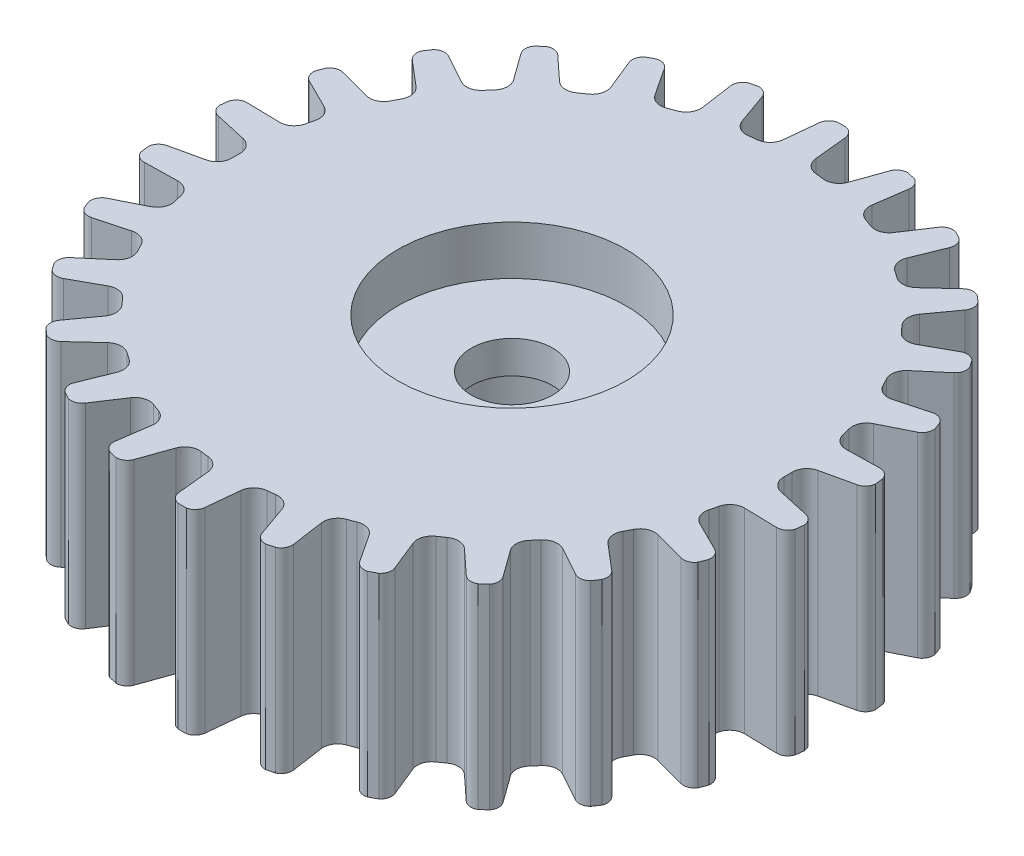
from build123d import *

# Parameters (mm, degrees)
SKETCH1_R           = 10.125
SKETCH1_R_2         = 2.45
BOSS_EXTRUDE1_DEPTH = 6
CUT_EXTRUDE1_START  = -6
SKETCH2_R           = 11.178148921
CUT_EXTRUDE1_DEPTH  = 6
BOSS_EXTRUDE2_START = -2.5
SKETCH3_R           = 2.45
SKETCH3_R_2         = 1.25
BOSS_EXTRUDE2_DEPTH = 2.5
SKETCH4_R           = 3.5
CUT_EXTRUDE2_DEPTH  = 1.5


with BuildPart() as part:
    # Sketch1 → Boss-Extrude1 (new body)
    with BuildSketch(Plane(origin=(0, 0, 0), x_dir=(1, 0, 0), z_dir=(0, 1, 0))):
        with Locations(Location((0, 0, 0), (0, 0, 270))):
            Circle(SKETCH1_R)
        with Locations(Location((0, 0, 0), (0, 0, 270))):
            Circle(SKETCH1_R_2, mode=Mode.SUBTRACT)
    extrude(amount=BOSS_EXTRUDE1_DEPTH)

    # Sketch2 → Cut-Extrude1 (cut)
    with BuildSketch(Plane(origin=(0, 6, 0), x_dir=(1, 0, 0), z_dir=(0, 1, 0)).offset(CUT_EXTRUDE1_START)):
        Circle(SKETCH2_R)
        with BuildLine():
            Line((0.5, 8.825), (0.4, 9.825))
            ThreePointArc((0.4, 9.825), (0.265875857, 10.062834476), (0, 10.125))
            ThreePointArc((0, 10.125), (-0.265875857, 10.062834476), (-0.4, 9.825))
            Line((-0.4, 9.825), (-0.5, 8.825))
            ThreePointArc((-0.5, 8.825), (-0.628607324, 8.553607324), (-0.9, 8.425))
            ThreePointArc((-0.9, 8.425), (-1.021299439, 8.411157617), (-1.142386836, 8.39556891))
            ThreePointArc((-1.142386836, 8.39556891), (-1.436671081, 8.45549062), (-1.626489829, 8.688219371))
            Line((-1.626489829, 8.688219371), (-1.962899675, 9.635229622))
            ThreePointArc((-1.962899675, 9.635229622), (-2.150043929, 9.834055052), (-2.423071101, 9.830785901))
            ThreePointArc((-2.423071101, 9.830785901), (-2.666343905, 9.706798537), (-2.739653129, 9.44377709))
            Line((-2.739653129, 9.44377709), (-2.597431646, 8.448903707))
            ThreePointArc((-2.597431646, 8.448903707), (-2.657353357, 8.154619462), (-2.890082107, 7.964800714))
            ThreePointArc((-2.890082107, 7.964800714), (-3.004544106, 7.922331709), (-3.118382301, 7.878217871))
            ThreePointArc((-3.118382301, 7.878217871), (-3.418455385, 7.865971536), (-3.65845398, 8.046511012))
            Line((-3.65845398, 8.046511012), (-4.211722755, 8.885494721))
            ThreePointArc((-4.211722755, 8.885494721), (-4.441010978, 9.033756094), (-4.705322117, 8.96524226))
            ThreePointArc((-4.705322117, 8.96524226), (-4.911853737, 8.78663875), (-4.920087576, 8.513716183))
            Line((-4.920087576, 8.513716183), (-4.543910006, 7.58178784))
            ThreePointArc((-4.543910006, 7.58178784), (-4.531663671, 7.281714757), (-4.712203148, 7.041716161))
            ThreePointArc((-4.712203148, 7.041716161), (-4.813175591, 6.97308868), (-4.913148722, 6.903013446))
            ThreePointArc((-4.913148722, 6.903013446), (-5.201571488, 6.819310778), (-5.477802085, 6.937168682))
            Line((-5.477802085, 6.937168682), (-6.215775818, 7.619367164))
            ThreePointArc((-6.215775818, 7.619367164), (-6.473882611, 7.708448068), (-6.714116915, 7.578671325))
            ThreePointArc((-6.714116915, 7.578671325), (-6.871904484, 7.355831457), (-6.814584416, 7.088869037))
            Line((-6.814584416, 7.088869037), (-6.226312833, 6.274046023))
            ThreePointArc((-6.226312833, 6.274046023), (-6.142610165, 5.985623258), (-6.260468069, 5.709392661))
            ThreePointArc((-6.260468069, 5.709392661), (-6.342082805, 5.618595082), (-6.422380798, 5.526630971))
            ThreePointArc((-6.422380798, 5.526630971), (-6.682391163, 5.376336464), (-6.978800243, 5.424663323))
            Line((-6.978800243, 5.424663323), (-7.858590584, 5.910429683))
            ThreePointArc((-7.858590584, 5.910429683), (-8.130515718, 5.935153059), (-8.332711642, 5.751655561))
            ThreePointArc((-8.332711642, 5.751655561), (-8.432585121, 5.497529977), (-8.313042381, 5.25204259))
            Line((-8.313042381, 5.25204259), (-7.54686499, 4.601679457))
            ThreePointArc((-7.54686499, 4.601679457), (-7.396570484, 4.341669092), (-7.444897342, 4.045260012))
            ThreePointArc((-7.444897342, 4.045260012), (-7.502411219, 3.937569161), (-7.558367446, 3.829060792))
            ThreePointArc((-7.558367446, 3.829060792), (-7.774854553, 3.620909018), (-8.074215898, 3.596896249))
            Line((-8.074215898, 3.596896249), (-9.04469263, 3.857999512))
            ThreePointArc((-9.04469263, 3.857999512), (-9.314632804, 3.816928528), (-9.467039457, 3.590374481))
            ThreePointArc((-9.467039457, 3.590374481), (-9.503194561, 3.319732038), (-9.328376539, 3.109986518))
            Line((-9.328376539, 3.109986518), (-8.428820785, 2.661880007))
            ThreePointArc((-8.428820785, 2.661880007), (-8.220669011, 2.445392901), (-8.196656243, 2.146031555))
            ThreePointArc((-8.196656243, 2.146031555), (-8.226726764, 2.027706032), (-8.255089252, 1.908959518))
            ThreePointArc((-8.255089252, 1.908959518), (-8.415471656, 1.6550475), (-8.700387474, 1.56009064))
            Line((-8.700387474, 1.56009064), (-9.705150016, 1.581356433))
            ThreePointArc((-9.705150016, 1.581356433), (-9.95741729, 1.476877985), (-10.05117735, 1.220433888))
            ThreePointArc((-10.05117735, 1.220433888), (-10.021512876, 0.949003339), (-9.80157936, 0.787189334))
            Line((-9.80157936, 0.787189334), (-8.820924154, 0.567381766))
            ThreePointArc((-8.820924154, 0.567381766), (-8.567012137, 0.406999362), (-8.472055277, 0.122083544))
            ThreePointArc((-8.472055277, 0.122083544), (-8.472934852, 0), (-8.472055277, -0.122083544))
            ThreePointArc((-8.472055277, -0.122083544), (-8.567012137, -0.406999362), (-8.820924154, -0.567381766))
            Line((-8.820924154, -0.567381766), (-9.80157936, -0.787189334))
            ThreePointArc((-9.80157936, -0.787189334), (-10.021512876, -0.949003339), (-10.05117735, -1.220433888))
            ThreePointArc((-10.05117735, -1.220433888), (-9.95741729, -1.476877985), (-9.705150016, -1.581356433))
            Line((-9.705150016, -1.581356433), (-8.700387474, -1.56009064))
            ThreePointArc((-8.700387474, -1.56009064), (-8.415471656, -1.6550475), (-8.255089252, -1.908959518))
            ThreePointArc((-8.255089252, -1.908959518), (-8.226726764, -2.027706032), (-8.196656243, -2.146031555))
            ThreePointArc((-8.196656243, -2.146031555), (-8.220669011, -2.445392901), (-8.428820785, -2.661880007))
            Line((-8.428820785, -2.661880007), (-9.328376539, -3.109986518))
            ThreePointArc((-9.328376539, -3.109986518), (-9.503194561, -3.319732038), (-9.467039457, -3.590374481))
            ThreePointArc((-9.467039457, -3.590374481), (-9.314632804, -3.816928528), (-9.04469263, -3.857999512))
            Line((-9.04469263, -3.857999512), (-8.074215898, -3.596896249))
            ThreePointArc((-8.074215898, -3.596896249), (-7.774854553, -3.620909018), (-7.558367446, -3.829060792))
            ThreePointArc((-7.558367446, -3.829060792), (-7.502411219, -3.937569161), (-7.444897342, -4.045260012))
            ThreePointArc((-7.444897342, -4.045260012), (-7.396570484, -4.341669092), (-7.54686499, -4.601679457))
            Line((-7.54686499, -4.601679457), (-8.313042381, -5.25204259))
            ThreePointArc((-8.313042381, -5.25204259), (-8.432585121, -5.497529977), (-8.332711642, -5.751655561))
            ThreePointArc((-8.332711642, -5.751655561), (-8.130515718, -5.935153059), (-7.858590584, -5.910429683))
            Line((-7.858590584, -5.910429683), (-6.978800243, -5.424663323))
            ThreePointArc((-6.978800243, -5.424663323), (-6.682391163, -5.376336464), (-6.422380798, -5.526630971))
            ThreePointArc((-6.422380798, -5.526630971), (-6.342082805, -5.618595082), (-6.260468069, -5.709392661))
            ThreePointArc((-6.260468069, -5.709392661), (-6.142610165, -5.985623258), (-6.226312833, -6.274046023))
            Line((-6.226312833, -6.274046023), (-6.814584416, -7.088869037))
            ThreePointArc((-6.814584416, -7.088869037), (-6.871904484, -7.355831457), (-6.714116915, -7.578671325))
            ThreePointArc((-6.714116915, -7.578671325), (-6.473882611, -7.708448068), (-6.215775818, -7.619367164))
            Line((-6.215775818, -7.619367164), (-5.477802085, -6.937168682))
            ThreePointArc((-5.477802085, -6.937168682), (-5.201571488, -6.819310778), (-4.913148722, -6.903013446))
            ThreePointArc((-4.913148722, -6.903013446), (-4.813175591, -6.97308868), (-4.712203148, -7.041716161))
            ThreePointArc((-4.712203148, -7.041716161), (-4.531663671, -7.281714757), (-4.543910006, -7.58178784))
            Line((-4.543910006, -7.58178784), (-4.920087576, -8.513716183))
            ThreePointArc((-4.920087576, -8.513716183), (-4.911853737, -8.78663875), (-4.705322117, -8.96524226))
            ThreePointArc((-4.705322117, -8.96524226), (-4.441010978, -9.033756094), (-4.211722755, -8.885494721))
            Line((-4.211722755, -8.885494721), (-3.65845398, -8.046511012))
            ThreePointArc((-3.65845398, -8.046511012), (-3.418455385, -7.865971536), (-3.118382301, -7.878217871))
            ThreePointArc((-3.118382301, -7.878217871), (-3.004544106, -7.922331709), (-2.890082107, -7.964800714))
            ThreePointArc((-2.890082107, -7.964800714), (-2.657353357, -8.154619462), (-2.597431646, -8.448903707))
            Line((-2.597431646, -8.448903707), (-2.739653129, -9.44377709))
            ThreePointArc((-2.739653129, -9.44377709), (-2.666343905, -9.706798537), (-2.423071101, -9.830785901))
            ThreePointArc((-2.423071101, -9.830785901), (-2.150043929, -9.834055052), (-1.962899675, -9.635229622))
            Line((-1.962899675, -9.635229622), (-1.626489829, -8.688219371))
            ThreePointArc((-1.626489829, -8.688219371), (-1.436671081, -8.45549062), (-1.142386836, -8.39556891))
            ThreePointArc((-1.142386836, -8.39556891), (-1.021299439, -8.411157617), (-0.9, -8.425))
            ThreePointArc((-0.9, -8.425), (-0.628607324, -8.553607324), (-0.5, -8.825))
            Line((-0.5, -8.825), (-0.4, -9.825))
            ThreePointArc((-0.4, -9.825), (-0.265875857, -10.062834476), (0, -10.125))
            ThreePointArc((0, -10.125), (0.265875857, -10.062834476), (0.4, -9.825))
            Line((0.4, -9.825), (0.5, -8.825))
            ThreePointArc((0.5, -8.825), (0.628607324, -8.553607324), (0.9, -8.425))
            ThreePointArc((0.9, -8.425), (1.021299439, -8.411157617), (1.142386836, -8.39556891))
            ThreePointArc((1.142386836, -8.39556891), (1.436671081, -8.45549062), (1.626489829, -8.688219371))
            Line((1.626489829, -8.688219371), (1.962899675, -9.635229622))
            ThreePointArc((1.962899675, -9.635229622), (2.150043929, -9.834055052), (2.423071101, -9.830785901))
            ThreePointArc((2.423071101, -9.830785901), (2.666343905, -9.706798537), (2.739653129, -9.44377709))
            Line((2.739653129, -9.44377709), (2.597431646, -8.448903707))
            ThreePointArc((2.597431646, -8.448903707), (2.657353357, -8.154619462), (2.890082107, -7.964800714))
            ThreePointArc((2.890082107, -7.964800714), (3.004544106, -7.922331709), (3.118382301, -7.878217871))
            ThreePointArc((3.118382301, -7.878217871), (3.418455385, -7.865971536), (3.65845398, -8.046511012))
            Line((3.65845398, -8.046511012), (4.211722755, -8.885494721))
            ThreePointArc((4.211722755, -8.885494721), (4.441010978, -9.033756094), (4.705322117, -8.96524226))
            ThreePointArc((4.705322117, -8.96524226), (4.911853737, -8.78663875), (4.920087576, -8.513716183))
            Line((4.920087576, -8.513716183), (4.543910006, -7.58178784))
            ThreePointArc((4.543910006, -7.58178784), (4.531663671, -7.281714757), (4.712203148, -7.041716161))
            ThreePointArc((4.712203148, -7.041716161), (4.813175591, -6.97308868), (4.913148722, -6.903013446))
            ThreePointArc((4.913148722, -6.903013446), (5.201571488, -6.819310778), (5.477802085, -6.937168682))
            Line((5.477802085, -6.937168682), (6.215775818, -7.619367164))
            ThreePointArc((6.215775818, -7.619367164), (6.473882611, -7.708448068), (6.714116915, -7.578671325))
            ThreePointArc((6.714116915, -7.578671325), (6.871904484, -7.355831457), (6.814584416, -7.088869037))
            Line((6.814584416, -7.088869037), (6.226312833, -6.274046023))
            ThreePointArc((6.226312833, -6.274046023), (6.142610165, -5.985623258), (6.260468069, -5.709392661))
            ThreePointArc((6.260468069, -5.709392661), (6.342082805, -5.618595082), (6.422380798, -5.526630971))
            ThreePointArc((6.422380798, -5.526630971), (6.682391163, -5.376336464), (6.978800243, -5.424663323))
            Line((6.978800243, -5.424663323), (7.858590584, -5.910429683))
            ThreePointArc((7.858590584, -5.910429683), (8.130515718, -5.935153059), (8.332711642, -5.751655561))
            ThreePointArc((8.332711642, -5.751655561), (8.432585121, -5.497529977), (8.313042381, -5.25204259))
            Line((8.313042381, -5.25204259), (7.54686499, -4.601679457))
            ThreePointArc((7.54686499, -4.601679457), (7.396570484, -4.341669092), (7.444897342, -4.045260012))
            ThreePointArc((7.444897342, -4.045260012), (7.502411219, -3.937569161), (7.558367446, -3.829060792))
            ThreePointArc((7.558367446, -3.829060792), (7.774854553, -3.620909018), (8.074215898, -3.596896249))
            Line((8.074215898, -3.596896249), (9.04469263, -3.857999512))
            ThreePointArc((9.04469263, -3.857999512), (9.314632804, -3.816928528), (9.467039457, -3.590374481))
            ThreePointArc((9.467039457, -3.590374481), (9.503194561, -3.319732038), (9.328376539, -3.109986518))
            Line((9.328376539, -3.109986518), (8.428820785, -2.661880007))
            ThreePointArc((8.428820785, -2.661880007), (8.220669011, -2.445392901), (8.196656243, -2.146031555))
            ThreePointArc((8.196656243, -2.146031555), (8.226726764, -2.027706032), (8.255089252, -1.908959518))
            ThreePointArc((8.255089252, -1.908959518), (8.415471656, -1.6550475), (8.700387474, -1.56009064))
            Line((8.700387474, -1.56009064), (9.705150016, -1.581356433))
            ThreePointArc((9.705150016, -1.581356433), (9.95741729, -1.476877985), (10.05117735, -1.220433888))
            ThreePointArc((10.05117735, -1.220433888), (10.021512876, -0.949003339), (9.80157936, -0.787189334))
            Line((9.80157936, -0.787189334), (8.820924154, -0.567381766))
            ThreePointArc((8.820924154, -0.567381766), (8.567012137, -0.406999362), (8.472055277, -0.122083544))
            ThreePointArc((8.472055277, -0.122083544), (8.472934852, 0), (8.472055277, 0.122083544))
            ThreePointArc((8.472055277, 0.122083544), (8.567012137, 0.406999362), (8.820924154, 0.567381766))
            Line((8.820924154, 0.567381766), (9.80157936, 0.787189334))
            ThreePointArc((9.80157936, 0.787189334), (10.021512876, 0.949003339), (10.05117735, 1.220433888))
            ThreePointArc((10.05117735, 1.220433888), (9.95741729, 1.476877985), (9.705150016, 1.581356433))
            Line((9.705150016, 1.581356433), (8.700387474, 1.56009064))
            ThreePointArc((8.700387474, 1.56009064), (8.415471656, 1.6550475), (8.255089252, 1.908959518))
            ThreePointArc((8.255089252, 1.908959518), (8.226726764, 2.027706032), (8.196656243, 2.146031555))
            ThreePointArc((8.196656243, 2.146031555), (8.220669011, 2.445392901), (8.428820785, 2.661880007))
            Line((8.428820785, 2.661880007), (9.328376539, 3.109986518))
            ThreePointArc((9.328376539, 3.109986518), (9.503194561, 3.319732038), (9.467039457, 3.590374481))
            ThreePointArc((9.467039457, 3.590374481), (9.314632804, 3.816928528), (9.04469263, 3.857999512))
            Line((9.04469263, 3.857999512), (8.074215898, 3.596896249))
            ThreePointArc((8.074215898, 3.596896249), (7.774854553, 3.620909018), (7.558367446, 3.829060792))
            ThreePointArc((7.558367446, 3.829060792), (7.502411219, 3.937569161), (7.444897342, 4.045260012))
            ThreePointArc((7.444897342, 4.045260012), (7.396570484, 4.341669092), (7.54686499, 4.601679457))
            Line((7.54686499, 4.601679457), (8.313042381, 5.25204259))
            ThreePointArc((8.313042381, 5.25204259), (8.432585121, 5.497529977), (8.332711642, 5.751655561))
            ThreePointArc((8.332711642, 5.751655561), (8.130515718, 5.935153059), (7.858590584, 5.910429683))
            Line((7.858590584, 5.910429683), (6.978800243, 5.424663323))
            ThreePointArc((6.978800243, 5.424663323), (6.682391163, 5.376336464), (6.422380798, 5.526630971))
            ThreePointArc((6.422380798, 5.526630971), (6.342082805, 5.618595082), (6.260468069, 5.709392661))
            ThreePointArc((6.260468069, 5.709392661), (6.142610165, 5.985623258), (6.226312833, 6.274046023))
            Line((6.226312833, 6.274046023), (6.814584416, 7.088869037))
            ThreePointArc((6.814584416, 7.088869037), (6.871904484, 7.355831457), (6.714116915, 7.578671325))
            ThreePointArc((6.714116915, 7.578671325), (6.473882611, 7.708448068), (6.215775818, 7.619367164))
            Line((6.215775818, 7.619367164), (5.477802085, 6.937168682))
            ThreePointArc((5.477802085, 6.937168682), (5.201571488, 6.819310778), (4.913148722, 6.903013446))
            ThreePointArc((4.913148722, 6.903013446), (4.813175591, 6.97308868), (4.712203148, 7.041716161))
            ThreePointArc((4.712203148, 7.041716161), (4.531663671, 7.281714757), (4.543910006, 7.58178784))
            Line((4.543910006, 7.58178784), (4.920087576, 8.513716183))
            ThreePointArc((4.920087576, 8.513716183), (4.911853737, 8.78663875), (4.705322117, 8.96524226))
            ThreePointArc((4.705322117, 8.96524226), (4.441010978, 9.033756094), (4.211722755, 8.885494721))
            Line((4.211722755, 8.885494721), (3.65845398, 8.046511012))
            ThreePointArc((3.65845398, 8.046511012), (3.418455385, 7.865971536), (3.118382301, 7.878217871))
            ThreePointArc((3.118382301, 7.878217871), (3.004544106, 7.922331709), (2.890082107, 7.964800714))
            ThreePointArc((2.890082107, 7.964800714), (2.657353357, 8.154619462), (2.597431646, 8.448903707))
            Line((2.597431646, 8.448903707), (2.739653129, 9.44377709))
            ThreePointArc((2.739653129, 9.44377709), (2.666343905, 9.706798537), (2.423071101, 9.830785901))
            ThreePointArc((2.423071101, 9.830785901), (2.150043929, 9.834055052), (1.962899675, 9.635229622))
            Line((1.962899675, 9.635229622), (1.626489829, 8.688219371))
            ThreePointArc((1.626489829, 8.688219371), (1.436671081, 8.45549062), (1.142386836, 8.39556891))
            ThreePointArc((1.142386836, 8.39556891), (1.021299439, 8.411157617), (0.9, 8.425))
            ThreePointArc((0.9, 8.425), (0.628607324, 8.553607324), (0.5, 8.825))
        make_face(mode=Mode.SUBTRACT)
    extrude(amount=CUT_EXTRUDE1_DEPTH, mode=Mode.SUBTRACT)

    # Sketch3 → Boss-Extrude2 (add)
    with BuildSketch(Plane(origin=(0, 6, 0), x_dir=(1, 0, 0), z_dir=(0, 1, 0)).offset(BOSS_EXTRUDE2_START)):
        with Locations(Location((0, 0, 0), (0, 0, 270))):
            Circle(SKETCH3_R)
        with Locations(Location((0, 0, 0), (0, 0, 270))):
            Circle(SKETCH3_R_2, mode=Mode.SUBTRACT)
    extrude(amount=BOSS_EXTRUDE2_DEPTH)

    # Sketch4 → Cut-Extrude2 (cut)
    with BuildSketch(Plane(origin=(0, 6, 0), x_dir=(1, 0, 0), z_dir=(0, 1, 0))):
        with Locations(Location((0, 0, 0), (0, 0, 270))):
            Circle(SKETCH4_R)
    extrude(amount=-CUT_EXTRUDE2_DEPTH, mode=Mode.SUBTRACT)


solid = part.part
